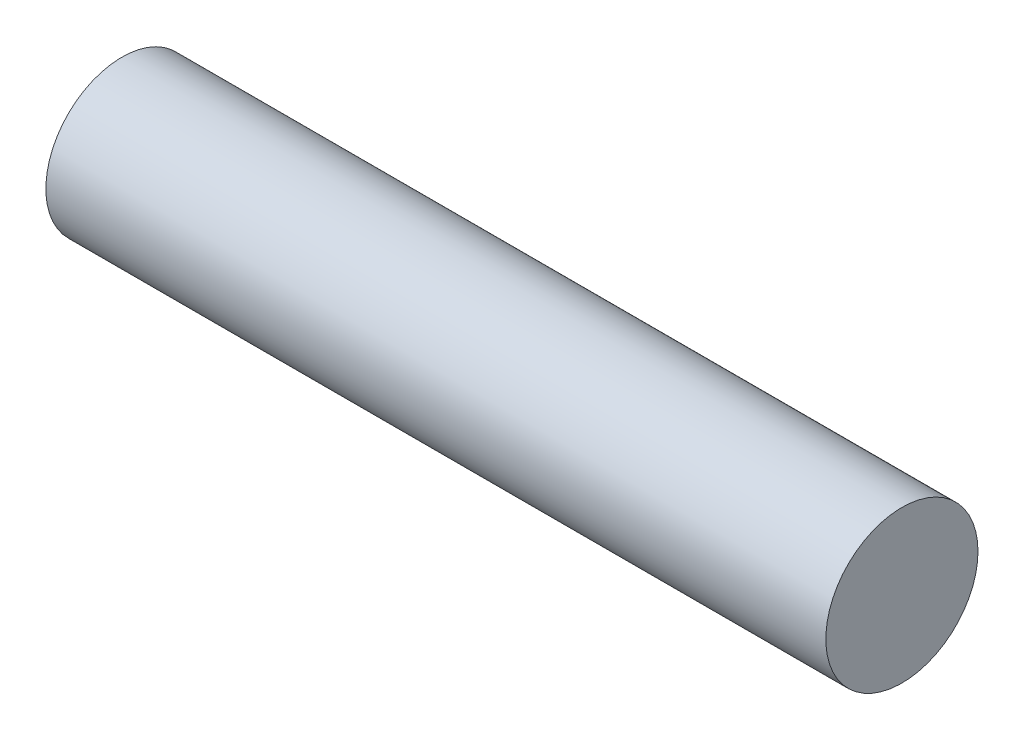
from build123d import *

# Parameters (mm, degrees)
SKETCH1_R           = 101.6
BOSS_EXTRUDE1_DEPTH = 1041.4


with BuildPart() as part:
    # Sketch1 → Boss-Extrude1 (new body)
    with BuildSketch(Plane(origin=(0, 0, 0), x_dir=(0, 0, -1), z_dir=(1, 0, 0))):
        Circle(SKETCH1_R)
    extrude(amount=BOSS_EXTRUDE1_DEPTH)


solid = part.part
